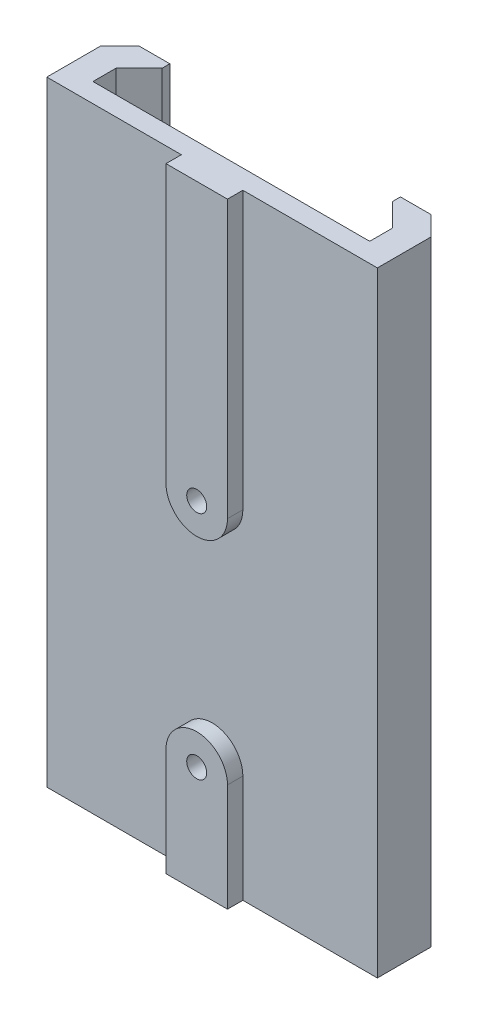
from build123d import *

# Parameters (mm, degrees)
SKETCH_1_W          = 43
SKETCH_1_H          = 80
EXTRUDE_1_DEPTH     = 9.5
CUT_EXTRUDE_1_DEPTH = 92.319494085
CHAMFER_1_SIZE      = 2.5
EXTRUDE_2_DEPTH     = 2
SKETCH_4_R          = 1.3
CUT_EXTRUDE_2_DEPTH = 92.549167118
SKETCH_5_R          = 2.15
CUT_EXTRUDE_3_DEPTH = 1.8
SKETCH_7_R          = 1.25
CUT_EXTRUDE_4_DEPTH = 5


with BuildPart() as part:
    # 草图1 → 凸台-拉伸1 (new body)
    with BuildSketch(Plane.XY):
        with Locations((21.5, -40)):
            Rectangle(SKETCH_1_W, SKETCH_1_H)
    extrude(amount=EXTRUDE_1_DEPTH)

    # 草图2 → 切除-拉伸1 (cut, through all)
    with BuildSketch(Plane(origin=(0, 0, 0), x_dir=(1, 0, 0), z_dir=(0, 1, 0))):
        Polygon((6.5, 0), (6.5, -1), (3.5, -4), (3.5, -7), (39.5, -7), (39.5, -4), (36.5, -1), (36.5, 0), align=None)
    extrude(amount=-CUT_EXTRUDE_1_DEPTH, mode=Mode.SUBTRACT)

    # 倒角1
    chamfer_1_edges = [part.edges().sort_by_distance(p)[0] for p in [
        (43, -40, 0),
        (0, -40, 0),
    ]]
    chamfer(chamfer_1_edges, length=CHAMFER_1_SIZE)

    # 草图3 → 凸台-拉伸2 (add)
    with BuildSketch(Plane.XY.offset(9.5)):
        with BuildLine():
            Line((17.5, -80), (25.5, -80))
            Line((25.5, -80), (25.5, -66))
            ThreePointArc((25.5, -66), (21.5, -62), (17.5, -66))
            Line((17.5, -66), (17.5, -80))
        make_face()
        with BuildLine():
            Line((17.5, -36), (17.5, 0))
            Line((17.5, 0), (25.5, 0))
            Line((25.5, 0), (25.5, -36))
            ThreePointArc((25.5, -36), (21.5, -40), (17.5, -36))
        make_face()
    extrude(amount=EXTRUDE_2_DEPTH)

    # 草图4 → 切除-拉伸2 (cut, through all)
    with BuildSketch(Plane.XY.offset(11.5)):
        with Locations((21.5, -36)):
            Circle(SKETCH_4_R)
        with Locations((21.5, -66)):
            Circle(SKETCH_4_R)
    extrude(amount=-CUT_EXTRUDE_2_DEPTH, mode=Mode.SUBTRACT)

    # 草图5 → 切除-拉伸3 (cut)
    with BuildSketch(Plane(origin=(0, 0, 7), x_dir=(-1, 0, 0), z_dir=(0, 0, -1))):
        with Locations((-21.5, -36)):
            Circle(SKETCH_5_R)
        with Locations((-21.5, -66)):
            Circle(SKETCH_5_R)
    extrude(amount=-CUT_EXTRUDE_3_DEPTH, mode=Mode.SUBTRACT)

    # 草图7 → 切除-拉伸4 (cut)
    with BuildSketch(Plane.ZY):
        with Locations(Location((5.2, -10, 0), (0, 0, 270))):
            Circle(SKETCH_7_R)
        with Locations(Location((5.2, -25, 0), (0, 0, 270))):
            Circle(SKETCH_7_R)
        with Locations(Location((5.2, -40, 0), (0, 0, 270))):
            Circle(SKETCH_7_R)
        with Locations(Location((5.2, -55, 0), (0, 0, 270))):
            Circle(SKETCH_7_R)
        with Locations(Location((5.2, -70, 0), (0, 0, 270))):
            Circle(SKETCH_7_R)
    extrude(amount=-CUT_EXTRUDE_4_DEPTH, mode=Mode.SUBTRACT)


solid = part.part
